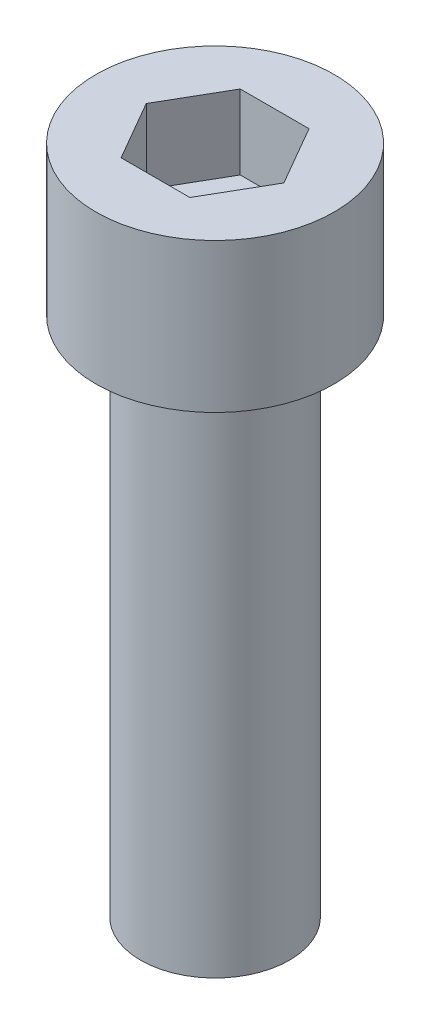
from build123d import *

# Parameters (mm, degrees)
CUT_EXTRUDE1_DEPTH = 5


with BuildPart() as part:
    # Sketch1 → Revolve1 (revolve)
    with BuildSketch(Plane.XY, mode=Mode.PRIVATE) as revolve1_sk:
        Polygon((0, -35), (5, -35), (5, 0), (8, 0), (8, 10), (0, 10), align=None)
    revolve(revolve1_sk.sketch.rotate(Axis((0, 61.691642626, 0), (0, -1, 0)), 90), axis=Axis((0, 61.691642626, 0), (0, -1, 0)))

    # Sketch2 → Cut-Extrude1 (cut)
    with BuildSketch(Plane(origin=(0, 10, 0), x_dir=(-1, 0, 0), z_dir=(0, 1, 0))):
        Polygon((-2.309401077, -4), (2.309401077, -4), (4.618802154, 0), (2.309401077, 4), (-2.309401077, 4), (-4.618802154, 0), align=None)
    extrude(amount=-CUT_EXTRUDE1_DEPTH, mode=Mode.SUBTRACT)


solid = part.part
